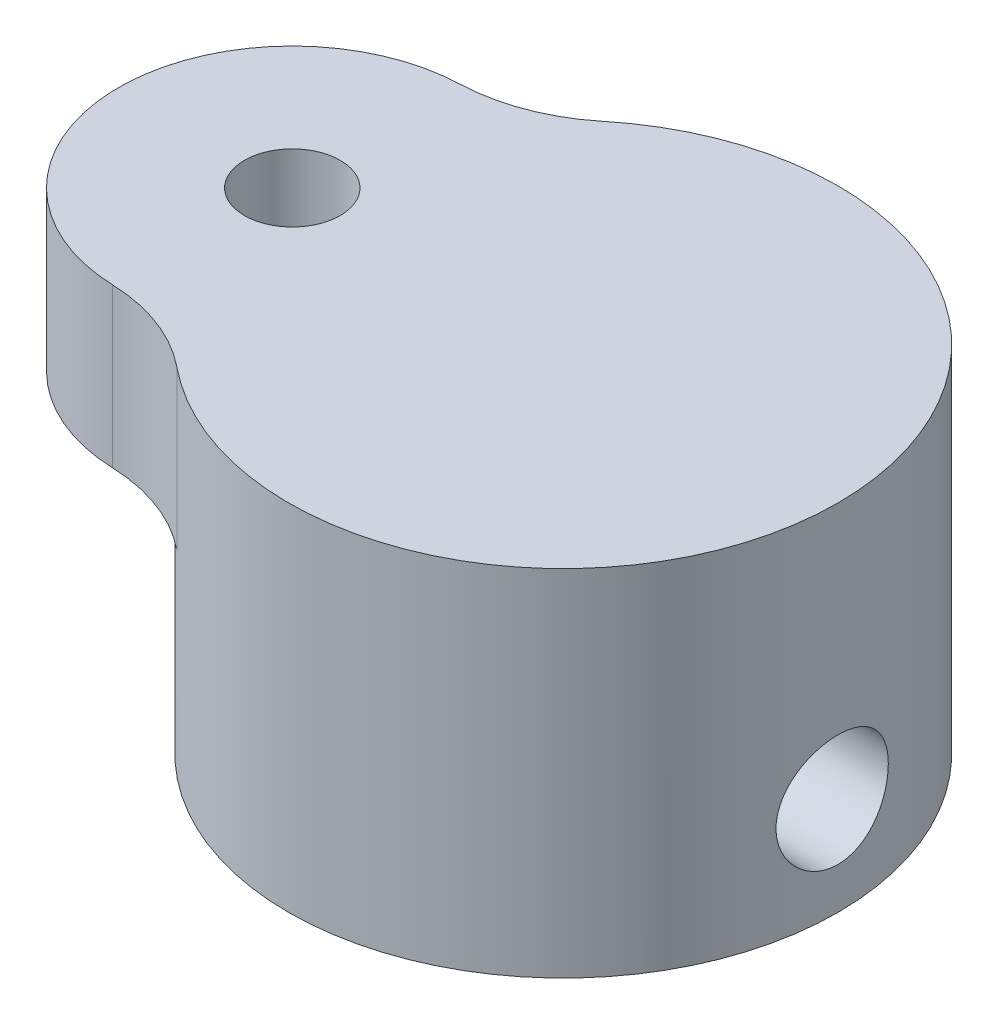
from build123d import *

# Parameters (mm, degrees)
SKETCH1_R               = 10.033
SKETCH1_R_2             = 6.35
BOSS_EXTRUDE1_DEPTH     = 7.1628
CUT_EXTRUDE1_DEPTH      = 16.894271982
CUT_EXTRUDE1_DEPTH_BACK = 16.894271982
SKETCH2_R               = 2.05105
SKETCH3_R               = 1.75
BOSS_EXTRUDE2_DEPTH     = 5.7912


with BuildPart() as part:
    # Sketch1 → Boss-Extrude1 (new body)
    with BuildSketch(Plane(origin=(0, 0, 0), x_dir=(1, 0, 0), z_dir=(0, 1, 0))):
        with Locations(Location((0, 0, 0), (0, 0, 270))):
            Circle(SKETCH1_R)
        with Locations(Location((0, 0, 0), (0, 0, 270))):
            Circle(SKETCH1_R_2, mode=Mode.SUBTRACT)
    extrude(amount=BOSS_EXTRUDE1_DEPTH)

    # Sketch2 → Cut-Extrude1 (cut, two sides: drawn at the far end of the back side and taken through both)
    with BuildSketch(Plane(origin=(0, 0, 0), x_dir=(0, 0, -1), z_dir=(1, 0, 0)).offset(-CUT_EXTRUDE1_DEPTH_BACK)):
        with Locations((0, 3.5687)):
            Circle(SKETCH2_R)
    extrude(amount=CUT_EXTRUDE1_DEPTH + CUT_EXTRUDE1_DEPTH_BACK, mode=Mode.SUBTRACT)

    # Sketch3 → Boss-Extrude2 (add)
    with BuildSketch(Plane(origin=(0, 7.1628, 0), x_dir=(1, 0, 0), z_dir=(0, 1, 0))):
        with BuildLine():
            ThreePointArc((-6.34436033, -7.772398665), (10.033, 0), (-6.34436033, 7.772398665))
            ThreePointArc((-6.34436033, 7.772398665), (-8.120246687, 6.749669096), (-10.12938913, 6.345819163))
            ThreePointArc((-10.12938913, 6.345819163), (-16.249, 0), (-10.12938913, -6.345819163))
            ThreePointArc((-10.12938913, -6.345819163), (-8.120246687, -6.749669096), (-6.34436033, -7.772398665))
        make_face()
        with Locations(Location((-9.899, 0, 0), (0, 0, 89.352367696))):
            Circle(SKETCH3_R, mode=Mode.SUBTRACT)
    extrude(amount=BOSS_EXTRUDE2_DEPTH)


solid = part.part
